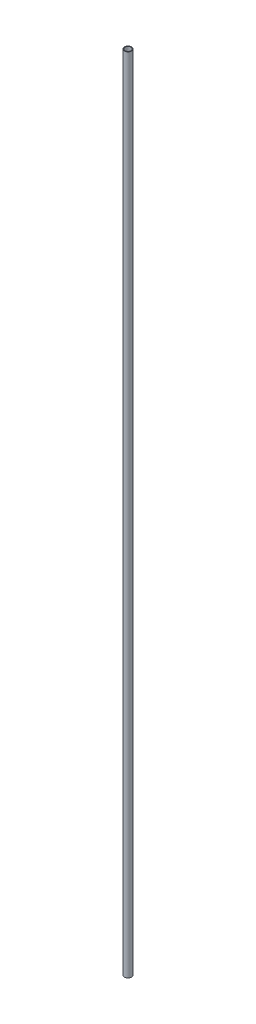
from build123d import *

# Parameters (mm, degrees)
SKETCH1_R           = 6.35
SKETCH1_R_2         = 5.35
BOSS_EXTRUDE1_DEPTH = 1419.5


with BuildPart() as part:
    # Sketch1 → Boss-Extrude1 (new body)
    with BuildSketch(Plane(origin=(0, 0, 0), x_dir=(1, 0, 0), z_dir=(0, 1, 0))):
        with Locations(Location((0, 0, 0), (0, 0, 270))):
            Circle(SKETCH1_R)
        with Locations(Location((0, 0, 0), (0, 0, 270))):
            Circle(SKETCH1_R_2, mode=Mode.SUBTRACT)
    extrude(amount=BOSS_EXTRUDE1_DEPTH)


solid = part.part
